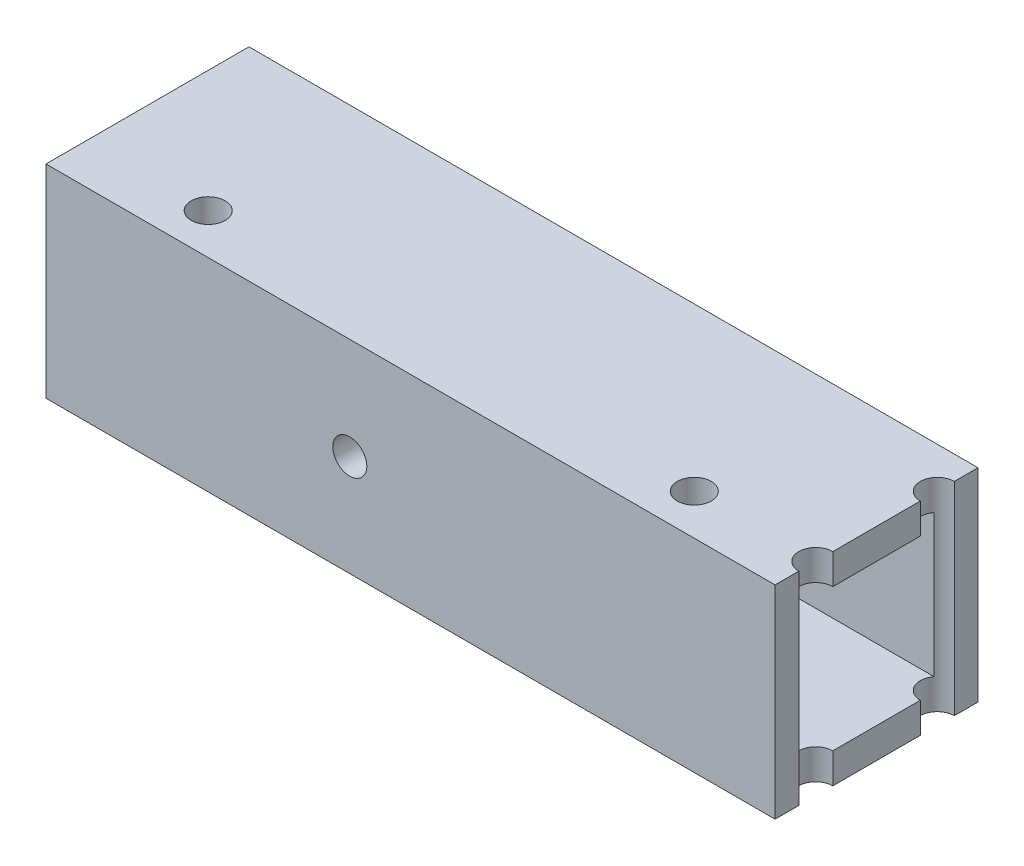
from build123d import *

# Parameters (mm, degrees)
BOSS_EXTRUDE1_DEPTH            = 5
SKETCH2_W                      = 120
SKETCH2_H                      = 5
BOSS_EXTRUDE2_DEPTH            = 3.9
SKETCH3_W                      = 120
SKETCH3_H                      = 5
BOSS_EXTRUDE3_DEPTH            = 3.9
BOSS_EXTRUDE4_START            = 23.4
BOSS_EXTRUDE4_DEPTH            = 23.4
BOSS_EXTRUDE5_START            = 23.4
BOSS_EXTRUDE5_DEPTH            = 23.4
BOSS_EXTRUDE6_START            = 5
BOSS_EXTRUDE6_DEPTH            = 5
SKETCH7_W                      = 2.8
SKETCH7_H                      = 33.4
SKETCH8_W                      = 2.8
SKETCH8_H                      = 33.4
F_5_6_5_6_DIAMETER_HOLE1_D     = 5.6
F_5_6_5_6_DIAMETER_HOLE2_D     = 5.6
F_5_6_5_6_DIAMETER_HOLE2_DEPTH = 5
F_5_6_5_6_DIAMETER_HOLE3_D     = 5.6
F_5_6_5_6_DIAMETER_HOLE3_DEPTH = 33.4


with BuildPart() as part:
    # Sketch1 → Boss-Extrude1 (new body)
    with BuildSketch(Plane.XZ.offset(110.3)):
        with BuildLine():
            Line((-150, 132.8), (-150, 107.2))
            Line((-150, 107.2), (-30, 107.2))
            ThreePointArc((-30, 107.2), (-27.2, 110), (-30, 112.8))
            Line((-30, 112.8), (-30, 127.2))
            ThreePointArc((-30, 127.2), (-27.2, 130), (-30, 132.8))
            Line((-30, 132.8), (-150, 132.8))
        make_face()
    extrude(amount=-BOSS_EXTRUDE1_DEPTH)

    # Sketch2 → Boss-Extrude2 (add)
    with BuildSketch(Plane(origin=(0, 0, 107.2), x_dir=(-1, 0, 0), z_dir=(0, 0, -1))):
        with Locations((90, -107.8)):
            Rectangle(SKETCH2_W, SKETCH2_H)
    extrude(amount=BOSS_EXTRUDE2_DEPTH)

    # Sketch3 → Boss-Extrude3 (add)
    with BuildSketch(Plane.XY.offset(132.8)):
        with Locations((-90, -107.8)):
            Rectangle(SKETCH3_W, SKETCH3_H)
    extrude(amount=BOSS_EXTRUDE3_DEPTH)

    # Sketch4 → Boss-Extrude4 (add)
    with BuildSketch(Plane.XZ.offset(110.3).offset(BOSS_EXTRUDE4_START)):
        with BuildLine():
            Line((-32.224859546, 131.7), (-150, 131.7))
            Line((-150, 131.7), (-150, 136.7))
            Line((-150, 136.7), (-30, 136.7))
            Line((-30, 136.7), (-30, 132.8))
            ThreePointArc((-30, 132.8), (-28.759032635, 127.49001992), (-32.224859546, 131.7))
        make_face()
    extrude(amount=-BOSS_EXTRUDE4_DEPTH)

    # Sketch5 → Boss-Extrude5 (add)
    with BuildSketch(Plane.XZ.offset(110.3).offset(BOSS_EXTRUDE5_START)):
        with BuildLine():
            Line((-150, 108.3), (-32.224859546, 108.3))
            ThreePointArc((-32.224859546, 108.3), (-28.759032635, 112.50998008), (-30, 107.2))
            Line((-30, 107.2), (-30, 103.3))
            Line((-30, 103.3), (-150, 103.3))
            Line((-150, 103.3), (-150, 108.3))
        make_face()
    extrude(amount=-BOSS_EXTRUDE5_DEPTH)

    # Sketch6 → Boss-Extrude6 (add)
    with BuildSketch(Plane.XZ.offset(133.7).offset(BOSS_EXTRUDE6_START)):
        with BuildLine():
            Line((-30, 107.2), (-30, 103.3))
            Line((-30, 103.3), (-150, 103.3))
            Line((-150, 103.3), (-150, 136.7))
            Line((-150, 136.7), (-30, 136.7))
            Line((-30, 136.7), (-30, 132.8))
            ThreePointArc((-30, 132.8), (-27.2, 130), (-30, 127.2))
            Line((-30, 127.2), (-30, 112.8))
            ThreePointArc((-30, 112.8), (-27.2, 110), (-30, 107.2))
        make_face()
    extrude(amount=-BOSS_EXTRUDE6_DEPTH)

    # Sketch7 → Cut-Revolve1 (revolve, cut)
    with BuildSketch(Plane.XY.offset(110)):
        with Locations((-28.6, -122)):
            Rectangle(SKETCH7_W, SKETCH7_H)
    revolve(axis=Axis((-30, -105.3, 110), (0, -1, 0)), mode=Mode.SUBTRACT)

    # Sketch8 → Cut-Revolve2 (revolve, cut)
    with BuildSketch(Plane.XY.offset(130)):
        with Locations((-28.6, -122)):
            Rectangle(SKETCH8_W, SKETCH8_H)
    revolve(axis=Axis((-30, -105.3, 130), (0, -1, 0)), mode=Mode.SUBTRACT)

    # Ø5.6 (5.6) Diameter Hole1 (through all)
    with Locations(Plane(origin=(0, -105.3, 0), x_dir=(1, 0, 0), z_dir=(0, 1, 0))):
        with Locations((-50, -130), (-130, -130)):
            Hole(F_5_6_5_6_DIAMETER_HOLE1_D / 2)

    # Ø5.6 (5.6) Diameter Hole2
    with Locations(Plane(origin=(0, 0, 131.7), x_dir=(-1, 0, 0), z_dir=(0, 0, -1))):
        with Locations((100, -122)):
            Hole(F_5_6_5_6_DIAMETER_HOLE2_D / 2, depth=F_5_6_5_6_DIAMETER_HOLE2_DEPTH)

    # Ø5.6 (5.6) Diameter Hole3
    with Locations(Plane(origin=(0, 0, 103.3), x_dir=(-1, 0, 0), z_dir=(0, 0, -1))):
        with Locations((100, -122)):
            Hole(F_5_6_5_6_DIAMETER_HOLE3_D / 2, depth=F_5_6_5_6_DIAMETER_HOLE3_DEPTH)


solid = part.part
